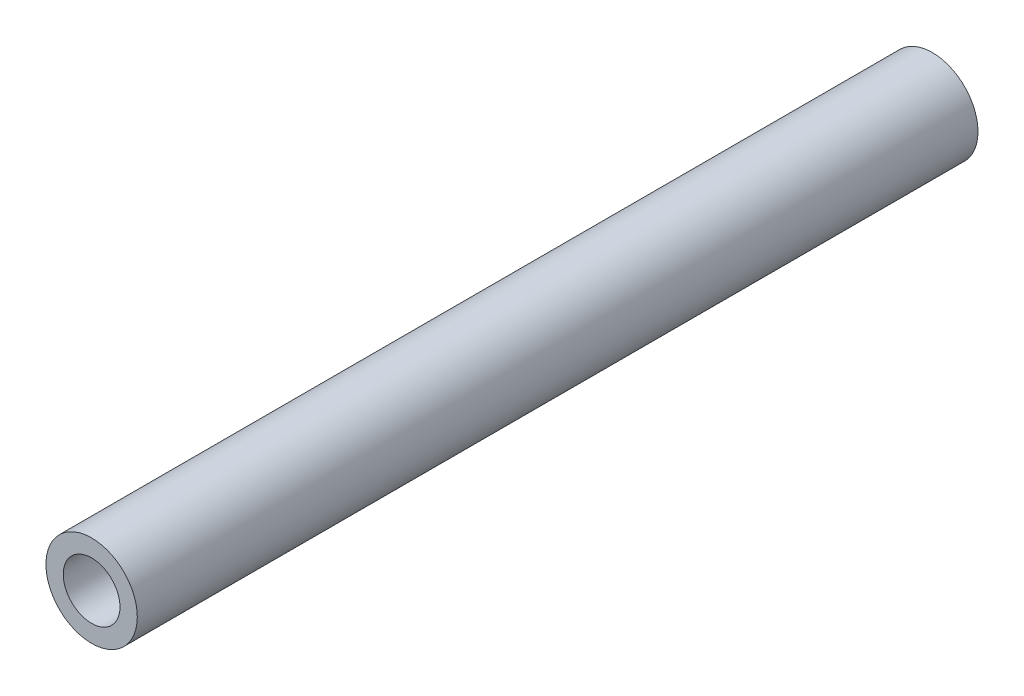
from build123d import *

# Parameters (mm, degrees)
SKETCH1_R           = 3.96875
SKETCH1_R_2         = 2.4638
BOSS_EXTRUDE1_DEPTH = 73.025


with BuildPart() as part:
    # Sketch1 → Boss-Extrude1 (new body)
    with BuildSketch(Plane.XY):
        Circle(SKETCH1_R)
        Circle(SKETCH1_R_2, mode=Mode.SUBTRACT)
    extrude(amount=BOSS_EXTRUDE1_DEPTH)


solid = part.part
